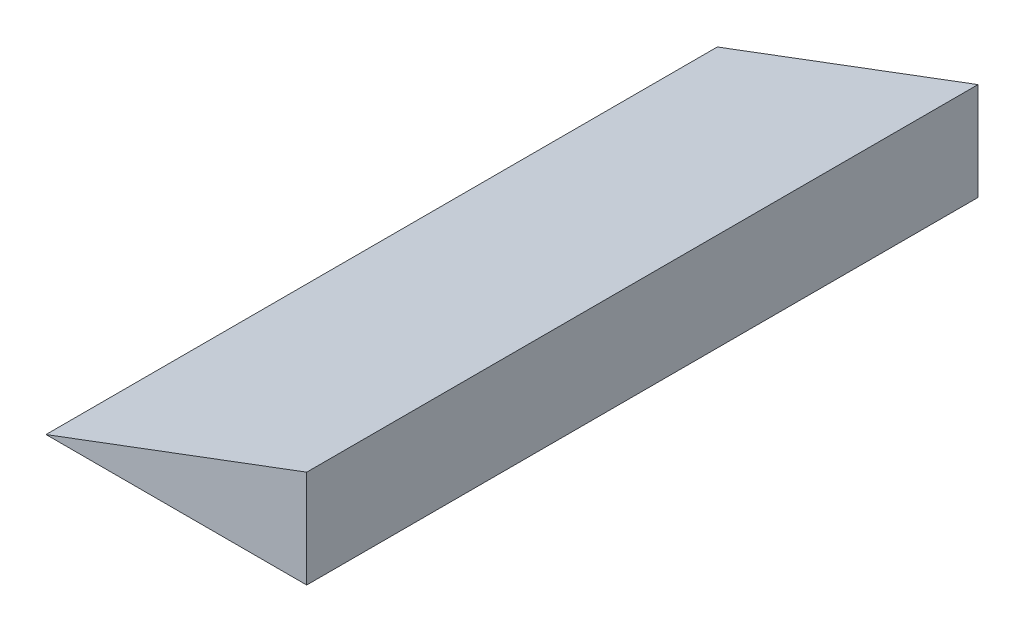
from build123d import *

# Parameters (mm, degrees)
BOSS_EXTRUDE1_DEPTH = 103


with BuildPart() as part:
    # Sketch1 → Boss-Extrude1 (new body)
    with BuildSketch(Plane.XY):
        Polygon((12, 15), (-28, 0), (12, 0), align=None)
    extrude(amount=BOSS_EXTRUDE1_DEPTH)


solid = part.part
